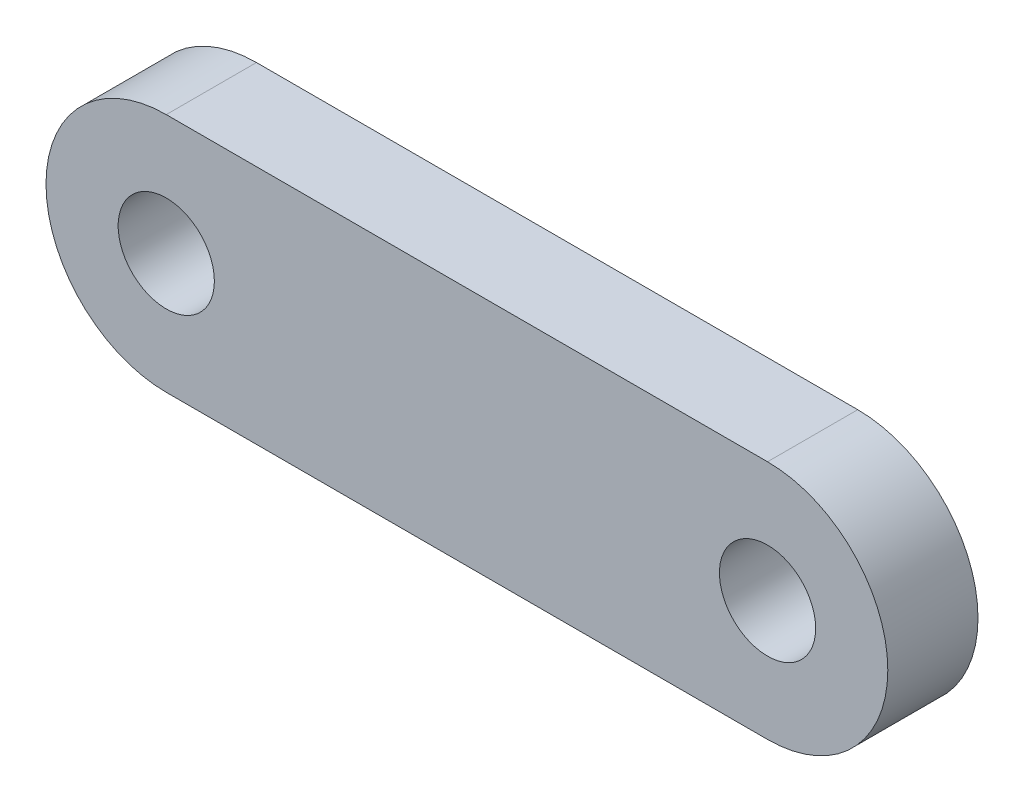
from build123d import *

# Parameters (mm, degrees)
SKETCH1_R           = 1.6
BOSS_EXTRUDE1_DEPTH = 3


with BuildPart() as part:
    # Sketch1 → Boss-Extrude1 (new body)
    with BuildSketch(Plane.XY):
        with BuildLine():
            Line((-10, 4), (10, 4))
            ThreePointArc((10, 4), (14, 0), (10, -4))
            Line((10, -4), (-10, -4))
            ThreePointArc((-10, -4), (-14, 0), (-10, 4))
        make_face()
        with Locations((-10, 0)):
            Circle(SKETCH1_R, mode=Mode.SUBTRACT)
        with Locations((10, 0)):
            Circle(SKETCH1_R, mode=Mode.SUBTRACT)
    extrude(amount=BOSS_EXTRUDE1_DEPTH)


solid = part.part
